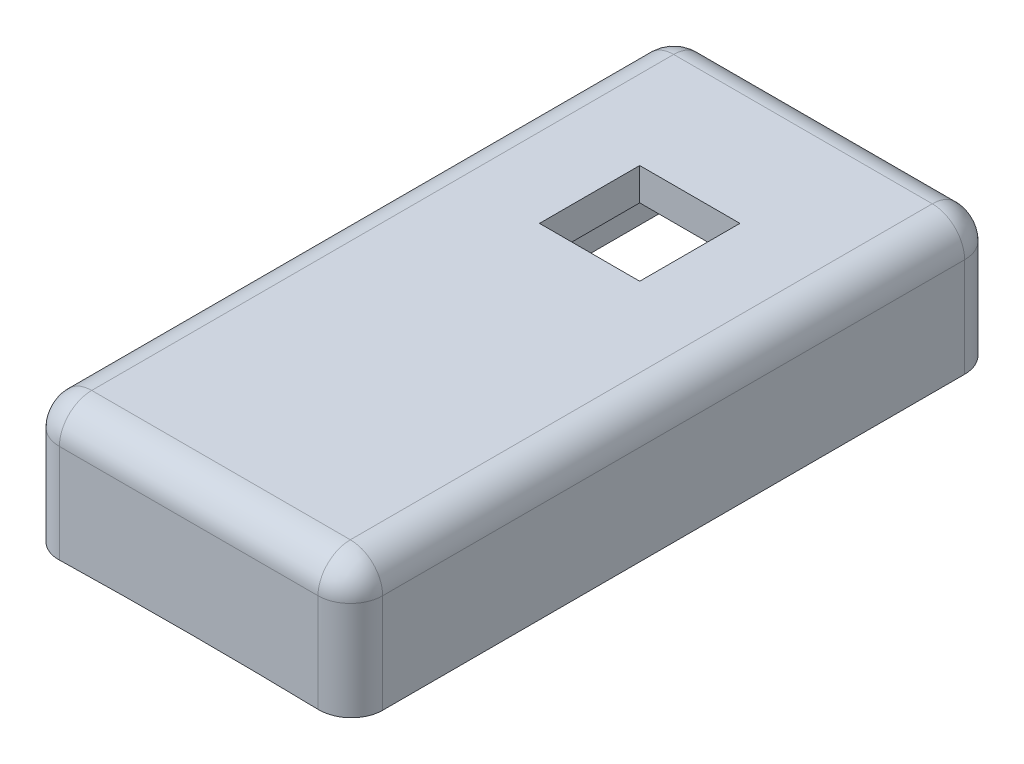
from build123d import *

# Parameters (mm, degrees)
BOSS_EXTRUDE1_DEPTH = 100
SKETCH4_W           = 40
SKETCH4_H           = 90
CUT_EXTRUDE1_DEPTH  = 150
SKETCH6_W           = 50
SKETCH6_H           = 100
SKETCH6_W_2         = 15.5
SKETCH6_H_2         = 15.5
BOSS_EXTRUDE2_DEPTH = 5
FILLET1_R           = 5
SKETCH7_W           = 15
SKETCH7_H           = 5
CUT_EXTRUDE2_DEPTH  = 5


with BuildPart() as part:
    # Sketch3 → Boss-Extrude1 (new body)
    with BuildSketch(Plane.XY):
        with BuildLine():
            Line((25, 935), (-25, 935))
            Line((-25, 935), (-25, 914.658406182))
            ThreePointArc((-25, 914.658406182), (0, 915), (25, 914.658406182))
            Line((25, 914.658406182), (25, 935))
        make_face()
    extrude(amount=BOSS_EXTRUDE1_DEPTH)

    # Sketch4 → Cut-Extrude1 (cut)
    with BuildSketch(Plane(origin=(0, 935, 0), x_dir=(1, 0, 0), z_dir=(0, 1, 0))):
        with Locations((0, -50)):
            Rectangle(SKETCH4_W, SKETCH4_H)
    extrude(amount=-CUT_EXTRUDE1_DEPTH, mode=Mode.SUBTRACT)

    # Sketch6 → Boss-Extrude2 (add)
    with BuildSketch(Plane(origin=(0, 935, 0), x_dir=(1, 0, 0), z_dir=(0, 1, 0))):
        with Locations((0, -50)):
            Rectangle(SKETCH6_W, SKETCH6_H)
        with Locations((0, -30.25)):
            Rectangle(SKETCH6_W_2, SKETCH6_H_2, mode=Mode.SUBTRACT)
    extrude(amount=-BOSS_EXTRUDE2_DEPTH)

    # Fillet1
    fillet1_edges = [part.edges().sort_by_distance(p)[0] for p in [
        (25, 924.829203091, 100),
        (0, 935, 100),
        (-25, 924.829203091, 100),
        (-25, 924.829203091, 0),
        (0, 935, 0),
        (25, 924.829203091, 0),
        (-25, 935, 50),
        (25, 935, 50),
    ]]
    fillet(fillet1_edges, radius=FILLET1_R)

    # Sketch7 → Cut-Extrude2 (cut)
    with BuildSketch(Plane.ZY.offset(25)):
        with Locations((87.5, 917.158406182)):
            Rectangle(SKETCH7_W, SKETCH7_H)
    extrude(amount=-CUT_EXTRUDE2_DEPTH, mode=Mode.SUBTRACT)


solid = part.part
